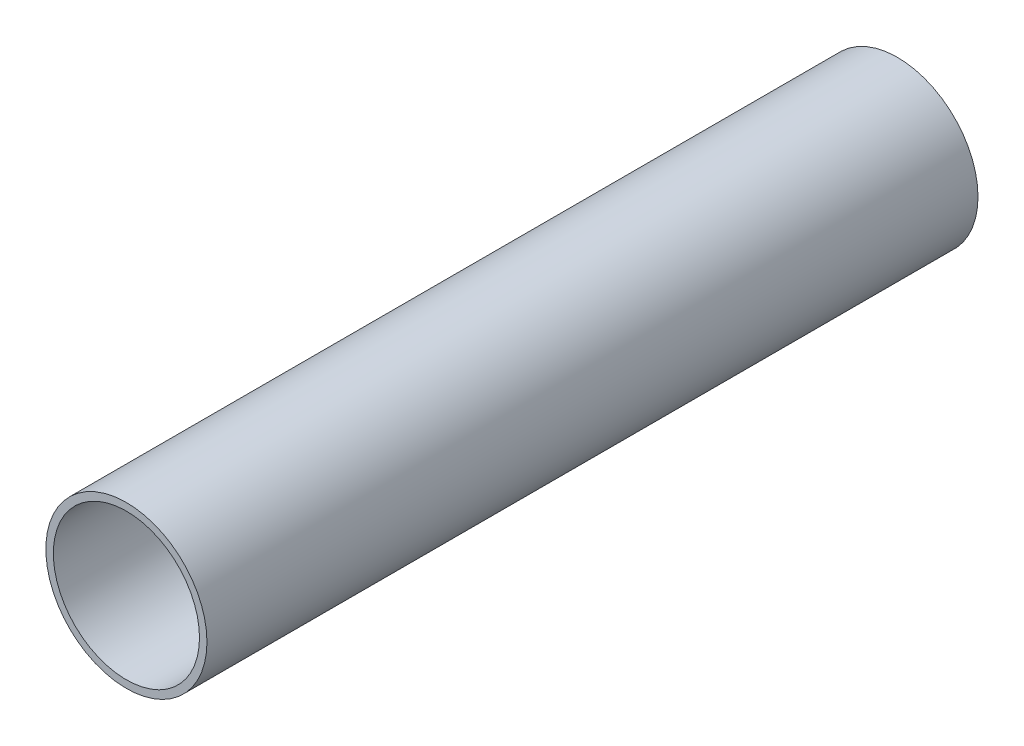
from build123d import *

# Parameters (mm, degrees)
SKETCH_1_R      = 14
SKETCH_1_R_2    = 12.7
EXTRUDE_1_DEPTH = 134


with BuildPart() as part:
    # 草图1 → 凸台-拉伸1 (new body)
    with BuildSketch(Plane.XY):
        Circle(SKETCH_1_R)
        Circle(SKETCH_1_R_2, mode=Mode.SUBTRACT)
    extrude(amount=EXTRUDE_1_DEPTH)


solid = part.part
